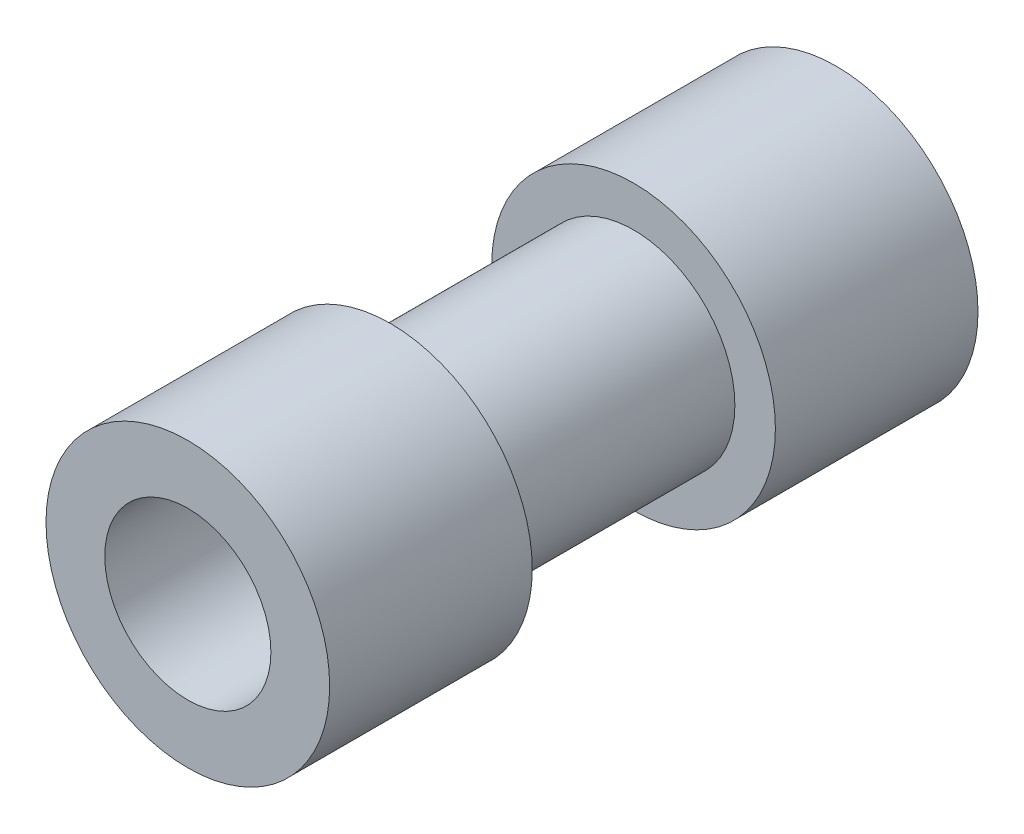
from build123d import *

# Parameters (mm, degrees)
SKETCH_1_R           = 1.75
EXTRUDE_1_DEPTH      = 2.5
SKETCH_2_R           = 1.25
EXTRUDE_2_DEPTH      = 3
SKETCH_3_R           = 1.75
EXTRUDE_3_DEPTH      = 2.5
HOLE_WIZARD_M2_5_1_D = 2.05


with BuildPart() as part:
    # 草图1 → 凸台-拉伸1 (new body)
    with BuildSketch(Plane.XY):
        Circle(SKETCH_1_R)
    extrude(amount=EXTRUDE_1_DEPTH)

    # 草图2 → 凸台-拉伸2 (add)
    with BuildSketch(Plane.XY.offset(2.5)):
        Circle(SKETCH_2_R)
    extrude(amount=EXTRUDE_2_DEPTH)

    # 草图3 → 凸台-拉伸3 (add)
    with BuildSketch(Plane.XY.offset(5.5)):
        Circle(SKETCH_3_R)
    extrude(amount=EXTRUDE_3_DEPTH)

    # M2.5 螺纹孔1 (through all)
    with Locations(Plane.XY.offset(8)):
        with Locations((0, 0)):
            Hole(HOLE_WIZARD_M2_5_1_D / 2)


solid = part.part
